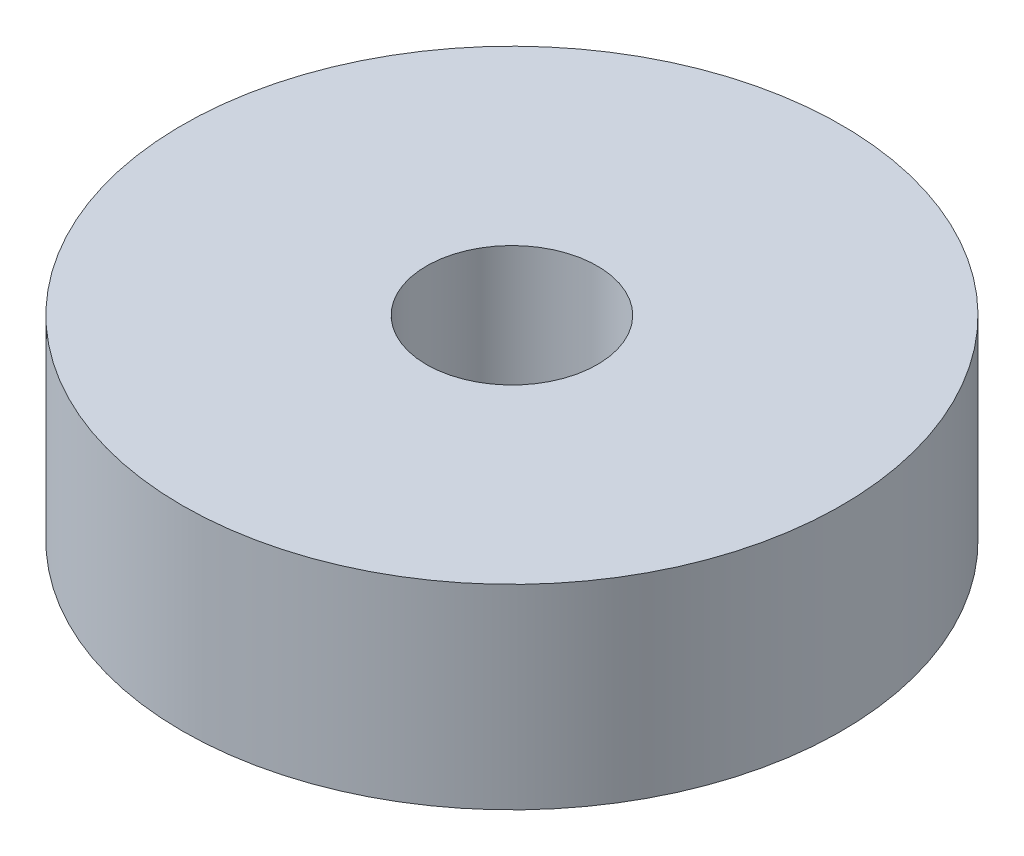
from build123d import *

# Parameters (mm, degrees)
SKETCH1_R           = 6.75
SKETCH1_R_2         = 1.75
BOSS_EXTRUDE1_DEPTH = 4


with BuildPart() as part:
    # Sketch1 → Boss-Extrude1 (new body)
    with BuildSketch(Plane(origin=(0, 0, 0), x_dir=(1, 0, 0), z_dir=(0, 1, 0))):
        with Locations(Location((0, 0, 0), (0, 0, 270))):
            Circle(SKETCH1_R)
        with Locations(Location((0, 0, 0), (0, 0, 270))):
            Circle(SKETCH1_R_2, mode=Mode.SUBTRACT)
    extrude(amount=BOSS_EXTRUDE1_DEPTH)


solid = part.part
